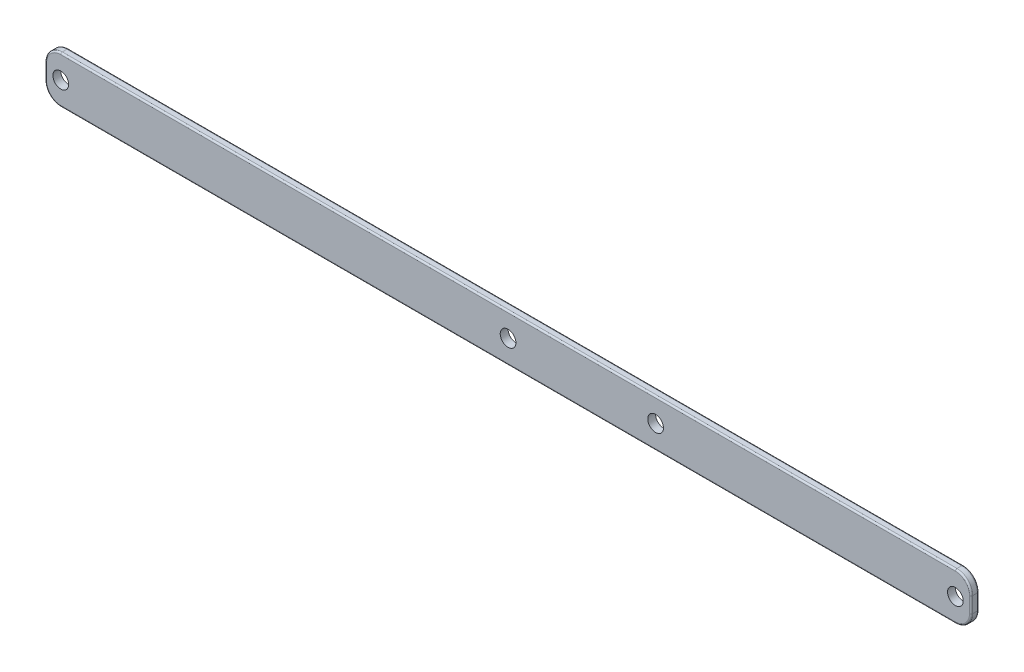
from build123d import *

# Parameters (mm, degrees)
SKETCH_1_W          = 590
SKETCH_1_H          = 30
SKETCH_1_R          = 5
EXTRUDE_1_DEPTH     = 5
FILLET_1_R          = 10
FILLET_2_R          = 1
CUT_EXTRUDE_1_REACH = 307.738
SKETCH_2_R          = 5


with BuildPart() as part:
    # 스케치1 → 보스-돌출1 (new body)
    with BuildSketch(Plane.XY):
        with Locations((5.677604278, 40.167322835)):
            Rectangle(SKETCH_1_W, SKETCH_1_H)
        with Locations((-279.322395722, 40.167322835)):
            Circle(SKETCH_1_R, mode=Mode.SUBTRACT)
        with Locations((290.677604278, 40.167322835)):
            Circle(SKETCH_1_R, mode=Mode.SUBTRACT)
        with Locations((5.677604278, 40.167322835)):
            Circle(SKETCH_1_R, mode=Mode.SUBTRACT)
    extrude(amount=EXTRUDE_1_DEPTH)

    # 필렛1
    fillet_1_edges = [part.edges().sort_by_distance(p)[0] for p in [
        (-289.322395722, 55.167322835, 2.5),
        (300.677604278, 55.167322835, 2.5),
        (300.677604278, 25.167322835, 2.5),
        (-289.322395722, 25.167322835, 2.5),
    ]]
    fillet(fillet_1_edges, radius=FILLET_1_R)

    # 필렛2
    fillet_2_edges = [part.edges().sort_by_distance(p)[0] for p in [
        (300.677604278, 40.167322835, 0),
        (300.677604278, 40.167322835, 5),
        (-289.322395722, 40.167322835, 0),
        (5.677604278, 55.167322835, 0),
        (5.677604278, 25.167322835, 0),
        (-286.393463534, 52.238390647, 0),
        (-286.393463534, 28.096255023, 0),
        (297.748672089, 52.238390647, 0),
        (297.748672089, 28.096255023, 0),
        (5.677604278, 25.167322835, 5),
        (-289.322395722, 40.167322835, 5),
        (5.677604278, 55.167322835, 5),
        (-286.393463534, 52.238390647, 5),
        (-286.393463534, 28.096255023, 5),
        (297.748672089, 52.238390647, 5),
        (297.748672089, 28.096255023, 5),
    ]]
    fillet(fillet_2_edges, radius=FILLET_2_R)

    # 스케치2 → 컷-돌출1 (cut, up to next)
    with BuildSketch(Plane.XY.offset(5), mode=Mode.PRIVATE) as cut_extrude_1_sk1:
        with Locations((99.677604278, 40.167322835)):
            Circle(SKETCH_2_R)
    cut_extrude_1_tool1 = extrude(cut_extrude_1_sk1.sketch, amount=-CUT_EXTRUDE_1_REACH, mode=Mode.PRIVATE) & part.part
    add(cut_extrude_1_tool1.solids().sort_by_distance((99.677604, 40.167323, 5))[0], mode=Mode.SUBTRACT)


solid = part.part
